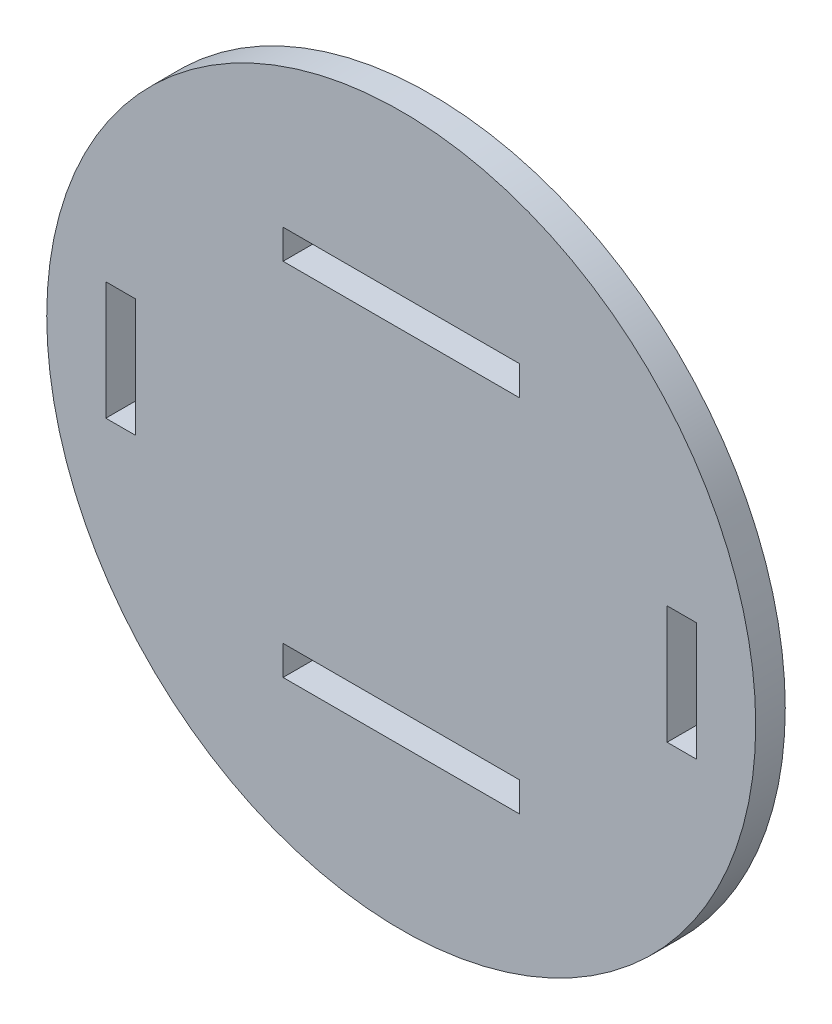
from build123d import *

# Parameters (mm, degrees)
SKETCH1_R           = 38.1
BOSS_EXTRUDE1_DEPTH = 3.175
CUT_EXTRUDE1_DEPTH  = 3.175


with BuildPart() as part:
    # Sketch1 → Boss-Extrude1 (new body)
    with BuildSketch(Plane.XY):
        Circle(SKETCH1_R)
    extrude(amount=BOSS_EXTRUDE1_DEPTH)

    # Sketch2 → Cut-Extrude1 (cut)
    with BuildSketch(Plane.XY):
        Polygon((0, 17.78), (12.7, 17.78), (12.7, 20.955), (-12.7, 20.955), (-12.7, 17.78), align=None)
        Polygon((0, -17.78), (12.7, -17.78), (12.7, -20.955), (-12.7, -20.955), (-12.7, -17.78), align=None)
        Polygon((-28.575, 0), (-28.575, -6.35), (-31.75, -6.35), (-31.75, 6.35), (-28.575, 6.35), align=None)
        Polygon((28.575, 0), (28.575, 6.35), (31.75, 6.35), (31.75, -6.35), (28.575, -6.35), align=None)
    extrude(amount=CUT_EXTRUDE1_DEPTH, mode=Mode.SUBTRACT)


solid = part.part
